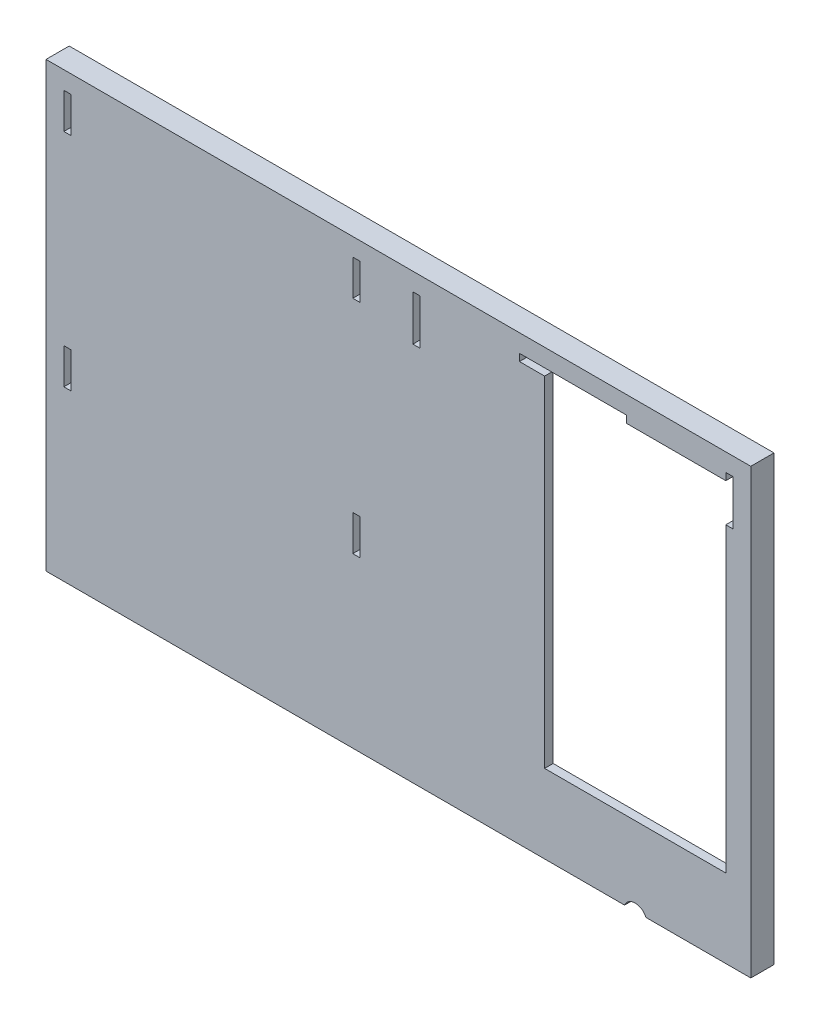
from build123d import *

# Parameters (mm, degrees)
SKETCH1_W           = 195.58
SKETCH1_H           = 244.475
BOSS_EXTRUDE1_DEPTH = 2.4
BOSS_EXTRUDE2_DEPTH = 4.5
BOSS_EXTRUDE3_DEPTH = 2
SKETCH4_W           = 2
SKETCH4_H           = 10
CUT_EXTRUDE1_DEPTH  = 2.4
SKETCH5_W           = 2
SKETCH5_H           = 12.7
CUT_EXTRUDE2_DEPTH  = 2.4
SKETCH6_R           = 3.25
CUT_EXTRUDE3_DEPTH  = 316.95890876
SKETCH7_W           = 248.705965207
SKETCH7_H           = 26.677752725
CUT_EXTRUDE4_DEPTH  = 234.430124033


with BuildPart() as part:
    # Sketch1 → Boss-Extrude1 (new body)
    with BuildSketch(Plane.XY):
        with Locations((97.79, 122.2375)):
            Rectangle(SKETCH1_W, SKETCH1_H)
    extrude(amount=BOSS_EXTRUDE1_DEPTH)

    # Sketch2 → Boss-Extrude2 (add)
    with BuildSketch(Plane.XY.offset(2.4)):
        Polygon((195.58, 0), (0, 0), (0, -2), (196.923366415, -2), (197.58, -2), (197.58, 246.475), (195.58, 246.475), (0, 246.475), (0, 244.475), (195.58, 244.475), align=None)
    extrude(amount=-BOSS_EXTRUDE2_DEPTH)

    # Sketch3 → Boss-Extrude3 (add)
    with BuildSketch(Plane(origin=(0, 0, -2.1), x_dir=(-1, 0, 0), z_dir=(0, 0, -1))):
        Polygon((0, -2), (-197.58, -2), (-197.58, 246.475), (0, 246.475), (0, 240.50625), (-195.58, 240.50625), (-195.58, 3.96875), (0, 3.96875), align=None)
    extrude(amount=BOSS_EXTRUDE3_DEPTH)

    # Sketch4 → Cut-Extrude1 (cut)
    with BuildSketch(Plane.XY.offset(2.4)):
        with Locations((6, 236.475)):
            Rectangle(SKETCH4_W, SKETCH4_H)
        with Locations((6, 174.475)):
            Rectangle(SKETCH4_W, SKETCH4_H)
        with Locations((87, 174.475)):
            Rectangle(SKETCH4_W, SKETCH4_H)
        with Locations((87, 236.475)):
            Rectangle(SKETCH4_W, SKETCH4_H)
    extrude(amount=-CUT_EXTRUDE1_DEPTH, mode=Mode.SUBTRACT)

    # Sketch5 → Cut-Extrude2 (cut)
    with BuildSketch(Plane.XY.offset(2.4)):
        Polygon((162.7175, 239.475), (190.58, 239.475), (190.58, 241.475), (192.58, 241.475), (192.58, 228.775), (190.58, 228.775), (190.58, 144.225), (139.78, 144.225), (139.78, 239.475), (132.7175, 239.475), (132.7175, 241.475), (162.7175, 241.475), align=None)
        with Locations((103.855, 235.125)):
            Rectangle(SKETCH5_W, SKETCH5_H)
    extrude(amount=-CUT_EXTRUDE2_DEPTH, mode=Mode.SUBTRACT)

    # Sketch6 → Cut-Extrude3 (cut, through all)
    with BuildSketch(Plane.XY.offset(2.4)):
        with Locations((165.18, 120.975)):
            Circle(SKETCH6_R)
        with Locations((165.18, 100.975)):
            Circle(SKETCH6_R)
        with Locations((165.18, 80.975)):
            Circle(SKETCH6_R)
        with Locations((165.18, 60.975)):
            Circle(SKETCH6_R)
        with Locations((165.18, 40.975)):
            Circle(SKETCH6_R)
    extrude(amount=-CUT_EXTRUDE3_DEPTH, mode=Mode.SUBTRACT)

    # Sketch7 → Cut-Extrude4 (cut, through all)
    with BuildSketch(Plane(origin=(0, 122.2375, 0), x_dir=(1, 0, 0), z_dir=(0, 1, 0))):
        with Locations((112.749873787, 1.388723817)):
            Rectangle(SKETCH7_W, SKETCH7_H)
    extrude(amount=-CUT_EXTRUDE4_DEPTH, mode=Mode.SUBTRACT)


solid = part.part
